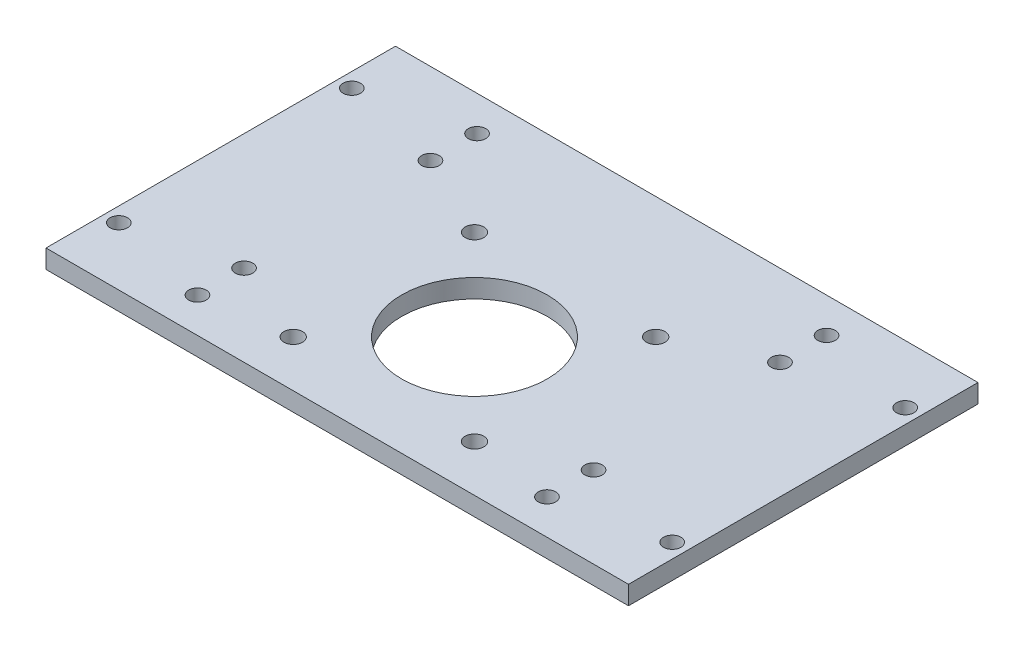
from build123d import *

# Parameters (mm, degrees)
SKETCH_1_W          = 100
SKETCH_1_H          = 60
EXTRUDE_1_DEPTH     = 3.2
SKETCH_2_R          = 12.5
SKETCH_2_R_2        = 1.6
SKETCH_2_R_3        = 1.5
CUT_EXTRUDE_1_DEPTH = 3.2


with BuildPart() as part:
    # 草图1 → 凸台-拉伸1 (new body)
    with BuildSketch(Plane(origin=(0, 0, 0), x_dir=(1, 0, 0), z_dir=(0, 1, 0))):
        Rectangle(SKETCH_1_W, SKETCH_1_H)
    extrude(amount=EXTRUDE_1_DEPTH)

    # 草图2 → 切除-拉伸1 (cut)
    with BuildSketch(Plane(origin=(0, 3.2, 0), x_dir=(1, 0, 0), z_dir=(0, 1, 0))):
        with Locations(Location((0, -6.443650814, 0), (0, 0, 270))):
            Circle(SKETCH_2_R)
        with Locations(Location((15.556349186, -22, 0), (0, 0, 270))):
            Circle(SKETCH_2_R_2)
        with Locations(Location((15.556349186, 9.112698372, 0), (0, 0, 270))):
            Circle(SKETCH_2_R_2)
        with Locations(Location((-15.556349186, 9.112698372, 0), (0, 0, 270))):
            Circle(SKETCH_2_R_2)
        with Locations(Location((-15.556349186, -22, 0), (0, 0, 270))):
            Circle(SKETCH_2_R_2)
        with Locations(Location((-47.5, 20, 0), (0, 0, 270))):
            Circle(SKETCH_2_R_3)
        with Locations(Location((-47.5, -20, 0), (0, 0, 270))):
            Circle(SKETCH_2_R_3)
        with Locations(Location((47.5, -20, 0), (0, 0, 270))):
            Circle(SKETCH_2_R_3)
        with Locations(Location((47.5, 20, 0), (0, 0, 270))):
            Circle(SKETCH_2_R_3)
        with Locations(Location((-30, -24, 0), (0, 0, 270))):
            Circle(SKETCH_2_R_3)
        with Locations(Location((-30, -16, 0), (0, 0, 270))):
            Circle(SKETCH_2_R_3)
        with Locations(Location((-30, 24, 0), (0, 0, 270))):
            Circle(SKETCH_2_R_3)
        with Locations(Location((-30, 16, 0), (0, 0, 270))):
            Circle(SKETCH_2_R_3)
        with Locations(Location((30, -24, 0), (0, 0, 270))):
            Circle(SKETCH_2_R_3)
        with Locations(Location((30, -16, 0), (0, 0, 270))):
            Circle(SKETCH_2_R_3)
        with Locations(Location((30, 24, 0), (0, 0, 270))):
            Circle(SKETCH_2_R_3)
        with Locations(Location((30, 16, 0), (0, 0, 270))):
            Circle(SKETCH_2_R_3)
    extrude(amount=-CUT_EXTRUDE_1_DEPTH, mode=Mode.SUBTRACT)


solid = part.part
